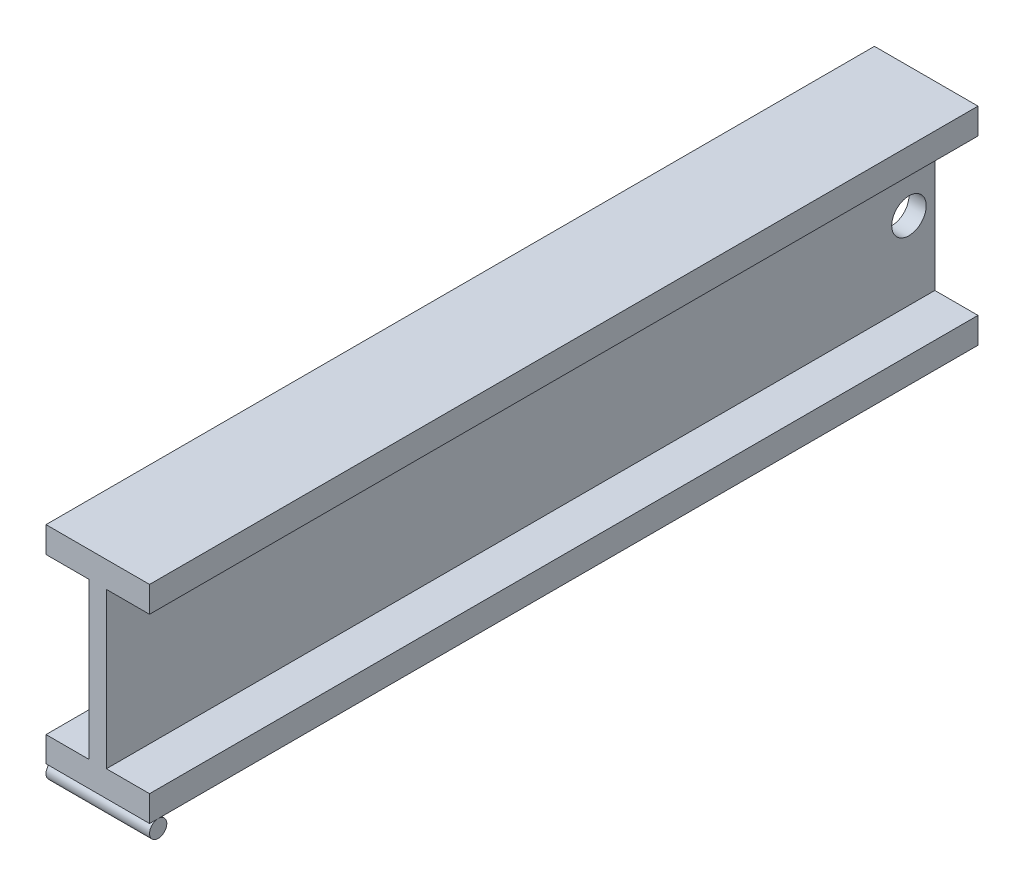
from build123d import *

# Parameters (mm, degrees)
BOSS_EXTRUDE1_DEPTH     = 1219.2
CUT_EXTRUDE1_DEPTH      = 11.43
CUT_EXTRUDE1_DEPTH_BACK = 41.148
SKETCH3_R               = 25.4
SKETCH4_R               = 12.7
BOSS_EXTRUDE2_DEPTH     = 152.4


with BuildPart() as part:
    # Sketch2 → Boss-Extrude1 (new body)
    with BuildSketch(Plane.XY):
        Polygon((-76.2, -152.4), (76.2, -152.4), (76.2, -114.3), (12.7, -114.3), (12.7, 114.3), (76.2, 114.3), (76.2, 152.4), (-76.2, 152.4), (-76.2, 114.3), (-12.7, 114.3), (-12.7, -115.168197492), (-76.2, -115.168197492), align=None)
    extrude(amount=BOSS_EXTRUDE1_DEPTH)

    # Sketch3 → Cut-Extrude1 (cut, two sides: drawn at the far end of the back side and taken through both)
    with BuildSketch(Plane.ZY.offset(12.7).offset(-CUT_EXTRUDE1_DEPTH_BACK)):
        with Locations(Location((38.1, 0, 0), (0, 0, 270))):
            Circle(SKETCH3_R)
    extrude(amount=CUT_EXTRUDE1_DEPTH + CUT_EXTRUDE1_DEPTH_BACK, mode=Mode.SUBTRACT)


with BuildPart() as body_2:
    # Sketch4 → Boss-Extrude2 (new body)
    with BuildSketch(Plane.ZY.offset(76.2)):
        with Locations((1206.5, -165.1)):
            Circle(SKETCH4_R)
    extrude(amount=-BOSS_EXTRUDE2_DEPTH)


solid = Compound([part.part, body_2.part])
